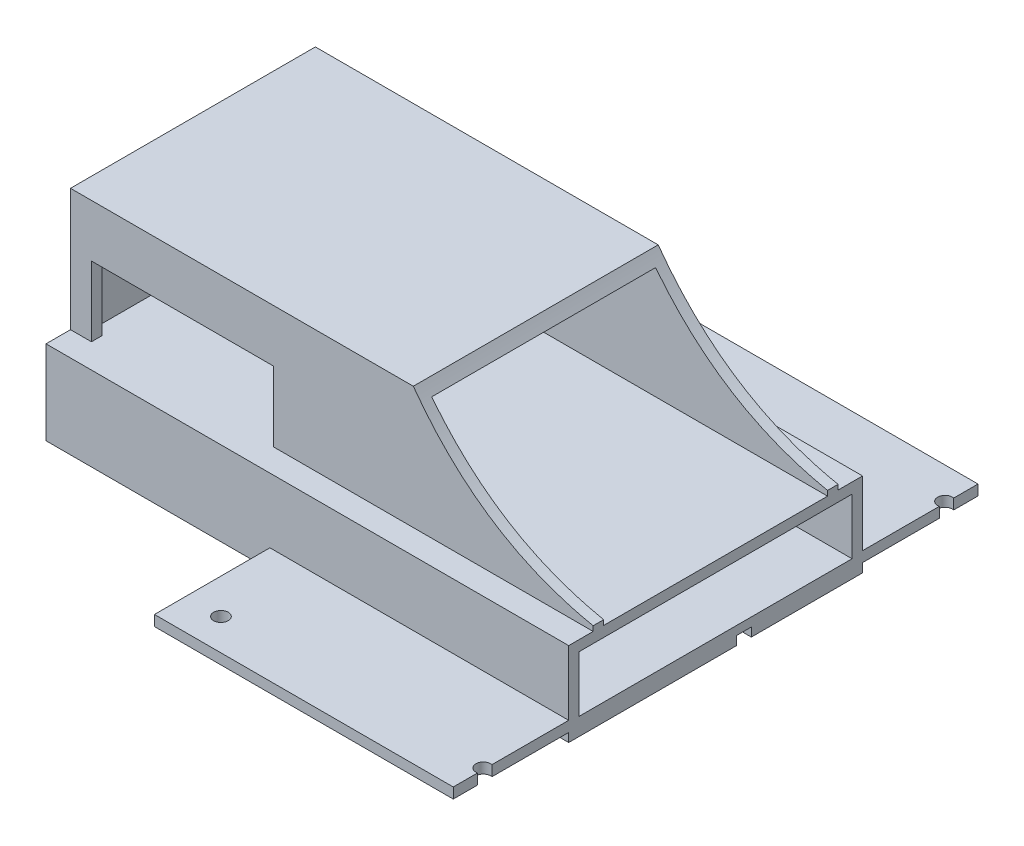
from build123d import *

# Parameters (mm, degrees)
ESQUISSE1_W                  = 156
ESQUISSE1_H                  = 84
BOSS_EXTRU_1_DEPTH           = 59
ESQUISSE2_W                  = 78
ESQUISSE2_H                  = 16
ESQUISSE2_W_2                = 7
ESQUISSE2_H_2                = 35
ESQUISSE2_W_3                = 4.2
ESQUISSE2_H_3                = 2.5
ENL_V_MAT_EXTRU_1_DEPTH      = 177.572550515
ENL_V_MAT_EXTRU_3_DEPTH      = 141.546285889
ESQUISSE4_W                  = 52
ESQUISSE4_H                  = 20
ENL_V_MAT_EXTRU_4_DEPTH      = 59
BOSS_EXTRU_2_DEPTH           = 34
ESQUISSE6_W                  = 95
ESQUISSE6_H                  = 3
BOSS_EXTRU_3_DEPTH           = 34
ESQUISSE8_R                  = 2.1
ENL_V_MAT_EXTRU_5_DEPTH      = 37
BOSS_EXTRU_4_DEPTH           = 3
ENL_V_MAT_EXTRU_6_DEPTH      = 30
ENL_V_MAT_EXTRU_6_DEPTH_BACK = 10
ESQUISSE10_W                 = 9.584266769
ESQUISSE10_H                 = 152
ESQUISSE11_W                 = 85.415733231
ESQUISSE11_H                 = 1
ENL_V_MAT_EXTRU_7_DEPTH      = 10


with BuildPart() as part:
    # Esquisse1 → Boss.-Extru.1 (new body)
    with BuildSketch(Plane(origin=(0, 0, 0), x_dir=(1, 0, 0), z_dir=(0, 1, 0))):
        with Locations((23.701811573, 15.972972973)):
            Rectangle(ESQUISSE1_W, ESQUISSE1_H)
    extrude(amount=BOSS_EXTRU_1_DEPTH)

    # Esquisse2 → Enlèv. mat.-Extru.1 (cut, through all)
    with BuildSketch(Plane(origin=(101.701811573, 0, 0), x_dir=(0, 0, -1), z_dir=(1, 0, 0))):
        Polygon((15.972972973, 24), (47.972972973, 24), (47.972972973, 56), (-16.027027027, 56), (-16.027027027, 24), align=None)
        with Locations((15.972972973, 13)):
            Rectangle(ESQUISSE2_W, ESQUISSE2_H)
        with Locations((-22.527027027, 41.5)):
            Rectangle(ESQUISSE2_W_2, ESQUISSE2_H_2)
        Polygon((54.972972973, 24), (57.972972973, 24), (57.972972973, 59), (50.972972973, 59), (50.972972973, 24), align=None)
        with Locations((24.072972973, 1.25)):
            Rectangle(ESQUISSE2_W_3, ESQUISSE2_H_3)
    extrude(amount=-ENL_V_MAT_EXTRU_1_DEPTH, mode=Mode.SUBTRACT)

    # Esquisse3 → Enlèv. mat.-Extru.3 (cut, through all)
    with BuildSketch(Plane.XY.offset(19.027027027)):
        with BuildLine():
            Line((101.701811573, 59), (40.701811573, 59))
            add(Edge.make_bspline(
                [(40.701811573, 59), (63.23269898, 27.796698054), (101.701811573, 24)],
                knots=[0, 0, 0, 1, 1, 1], degree=2))
            Line((101.701811573, 24), (101.701811573, 59))
        make_face()
    extrude(amount=-ENL_V_MAT_EXTRU_3_DEPTH, mode=Mode.SUBTRACT)

    # Esquisse4 → Enlèv. mat.-Extru.4 (cut)
    with BuildSketch(Plane.XY.offset(19.027027027)):
        with Locations((-25.298188427, 34)):
            Rectangle(ESQUISSE4_W, ESQUISSE4_H)
    extrude(amount=-ENL_V_MAT_EXTRU_4_DEPTH, mode=Mode.SUBTRACT)

    # Esquisse5 → Boss.-Extru.2 (add)
    with BuildSketch(Plane(origin=(0, 0, -57.972972973), x_dir=(-1, 0, 0), z_dir=(0, 0, -1))):
        Polygon((-101.701811573, 2.5), (-40.701811573, 2.75), (-40.701811573, 5.5), (-101.701811573, 5.5), align=None)
        Polygon((-40.701811573, 2.75), (-6.701811573, 2.660526316), (-6.701811573, 5.5), (-40.701811573, 5.5), align=None)
    extrude(amount=BOSS_EXTRU_2_DEPTH)

    # Esquisse6 → Boss.-Extru.3 (add)
    with BuildSketch(Plane.XY.offset(26.027027027)):
        with Locations((54.201811573, 4)):
            Rectangle(ESQUISSE6_W, ESQUISSE6_H)
    extrude(amount=BOSS_EXTRU_3_DEPTH)

    # Esquisse8 → Enlèv. mat.-Extru.5 (cut)
    with BuildSketch(Plane(origin=(0, 5.5, 0), x_dir=(1, 0, 0), z_dir=(0, 1, 0))):
        with Locations(Location((16.701811573, -50.027027027, 0), (0, 0, 180))):
            Circle(ESQUISSE8_R)
        with Locations(Location((91.701811573, -50.027027027, 0), (0, 0, 180))):
            Circle(ESQUISSE8_R)
        with Locations(Location((16.701811573, 81.972972973, 0), (0, 0, 180))):
            Circle(ESQUISSE8_R)
        with Locations(Location((91.701811573, 81.972972973, 0), (0, 0, 180))):
            Circle(ESQUISSE8_R)
    extrude(amount=-ENL_V_MAT_EXTRU_5_DEPTH, mode=Mode.SUBTRACT)

    # Esquisse9 → Boss.-Extru.4 (add)
    with BuildSketch(Plane.ZY.offset(54.298188427)):
        Polygon((-57.972972973, 0), (-57.972972973, 24), (-50.972972973, 24), (-50.972972973, 59), (19.027027027, 59), (19.027027027, 24), (26.027027027, 24), (26.027027027, 0), (-21.972972973, 0), (-21.972972973, 2.5), (-26.172972973, 2.5), (-26.172972973, 0), align=None)
    extrude(amount=BOSS_EXTRU_4_DEPTH)

    # Esquisse10 → Enlèv. mat.-Extru.6 (cut, two sides: drawn at the far end of the back side and taken through both)
    with BuildSketch(Plane(origin=(0, 5.5, 0), x_dir=(1, 0, 0), z_dir=(0, 1, 0)).offset(-ENL_V_MAT_EXTRU_6_DEPTH_BACK)):
        with Locations((96.909678189, 15.972972973)):
            Rectangle(ESQUISSE10_W, ESQUISSE10_H)
    extrude(amount=ENL_V_MAT_EXTRU_6_DEPTH + ENL_V_MAT_EXTRU_6_DEPTH_BACK, mode=Mode.SUBTRACT)

    # Esquisse11 → Enlèv. mat.-Extru.7 (cut)
    with BuildSketch(Plane(origin=(0, 5.5, 0), x_dir=(1, 0, 0), z_dir=(0, 1, 0))):
        with Locations((49.409678189, 91.472972973)):
            Rectangle(ESQUISSE11_W, ESQUISSE11_H)
        with Locations((49.409678189, -59.527027027)):
            Rectangle(ESQUISSE11_W, ESQUISSE11_H)
    extrude(amount=-ENL_V_MAT_EXTRU_7_DEPTH, mode=Mode.SUBTRACT)


solid = part.part
